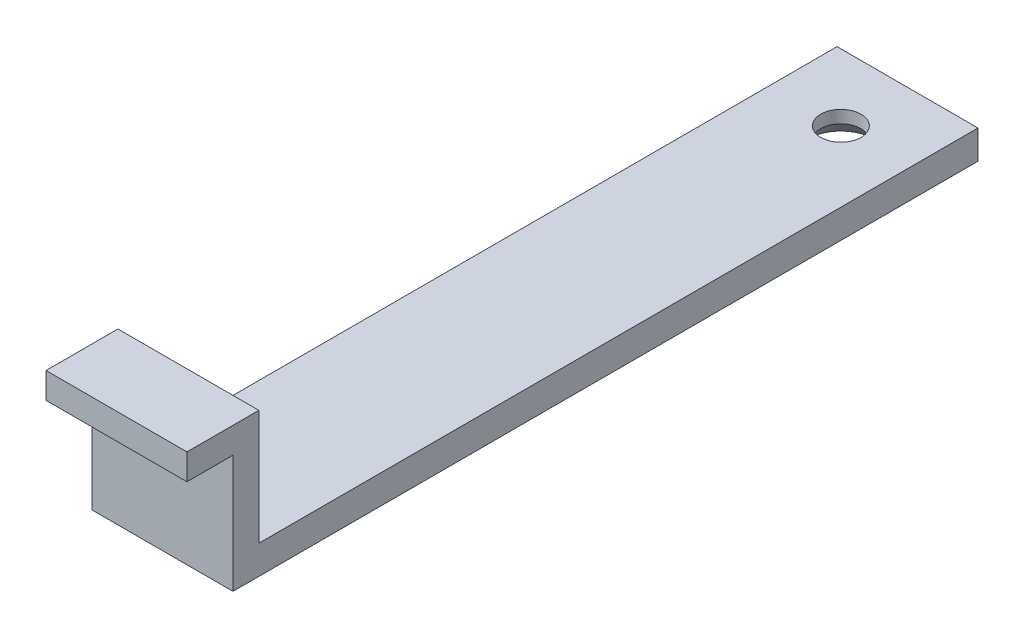
from build123d import *

# Parameters (mm, degrees)
SKETCH1_W                                      = 6.223
SKETCH1_H                                      = 1.143
BOSS_EXTRUDE1_DEPTH                            = 3.175
SKETCH2_W                                      = 6.223
SKETCH2_H                                      = 1.143
BOSS_EXTRUDE2_DEPTH                            = 2.032
SKETCH3_W                                      = 6.223
SKETCH3_H                                      = 1.27
BOSS_EXTRUDE3_DEPTH                            = 31.75
CSK_FOR_0_FLAT_HEAD_MACHINE_SCREW1_D           = 1.778
CSK_FOR_0_FLAT_HEAD_MACHINE_SCREW1_DEPTH       = 4.572
CSK_FOR_0_FLAT_HEAD_MACHINE_SCREW1_CSINK_D     = 3.0226
CSK_FOR_0_FLAT_HEAD_MACHINE_SCREW1_CSINK_ANGLE = 82
CSK_FOR_0_FLAT_HEAD_MACHINE_SCREW1_TIP         = 0.53416509


with BuildPart() as part:
    # Sketch1 → Boss-Extrude1 (new, symmetric)
    with BuildSketch(Plane(origin=(0, 0, 0), x_dir=(1, 0, 0), z_dir=(0, 1, 0))):
        Rectangle(SKETCH1_W, SKETCH1_H)
    extrude(amount=BOSS_EXTRUDE1_DEPTH, both=True)

    # Sketch2 → Boss-Extrude2 (add)
    with BuildSketch(Plane.XY.offset(0.5715)):
        with Locations((0, 2.6035)):
            Rectangle(SKETCH2_W, SKETCH2_H)
    extrude(amount=BOSS_EXTRUDE2_DEPTH)

    # Sketch3 → Boss-Extrude3 (add)
    with BuildSketch(Plane(origin=(0, 0, -0.5715), x_dir=(-1, 0, 0), z_dir=(0, 0, -1))):
        with Locations((0, -2.54)):
            Rectangle(SKETCH3_W, SKETCH3_H)
    extrude(amount=BOSS_EXTRUDE3_DEPTH)

    # CSK for #0 Flat Head Machine Screw1
    with Locations(Plane(origin=(0, -3.175, 0), x_dir=(-1, 0, 0), z_dir=(0, -1, 0))):
        with Locations((0, 29.378038883)):
            CounterSinkHole(CSK_FOR_0_FLAT_HEAD_MACHINE_SCREW1_D / 2, CSK_FOR_0_FLAT_HEAD_MACHINE_SCREW1_CSINK_D / 2, depth=CSK_FOR_0_FLAT_HEAD_MACHINE_SCREW1_DEPTH, counter_sink_angle=CSK_FOR_0_FLAT_HEAD_MACHINE_SCREW1_CSINK_ANGLE)
            with Locations((0, 0, -(CSK_FOR_0_FLAT_HEAD_MACHINE_SCREW1_DEPTH + CSK_FOR_0_FLAT_HEAD_MACHINE_SCREW1_TIP / 2))):  # 118° drill point
                Cone(0, CSK_FOR_0_FLAT_HEAD_MACHINE_SCREW1_D / 2, CSK_FOR_0_FLAT_HEAD_MACHINE_SCREW1_TIP, mode=Mode.SUBTRACT)


solid = part.part
